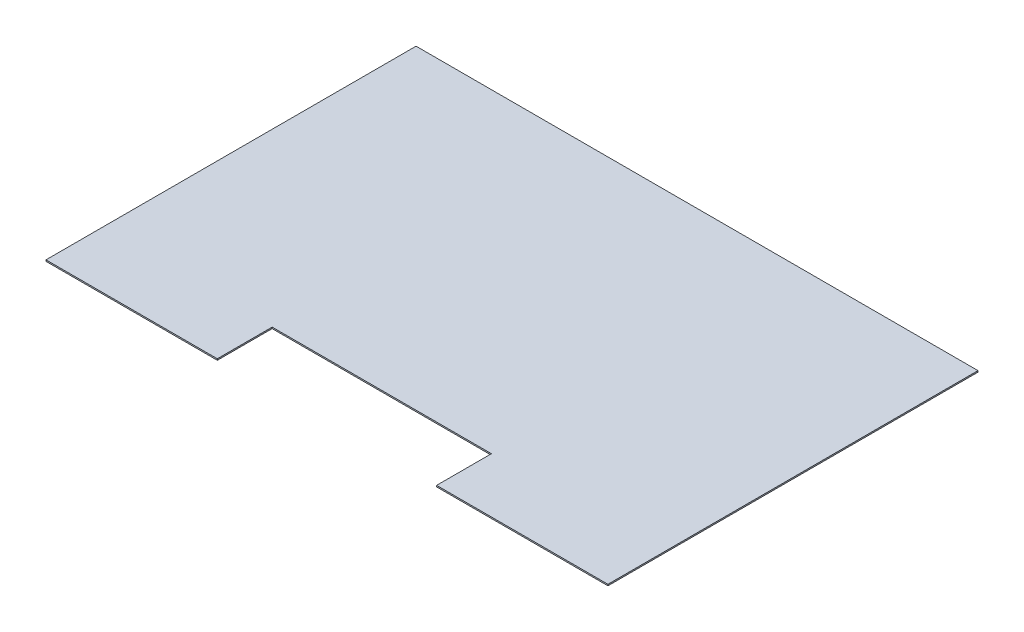
from build123d import *

# Parameters (mm, degrees)
DODANIE_WYCI_GNI_CIE1_DEPTH = 1


with BuildPart() as part:
    # Szkic1 → Dodanie-wyciągnięcie1 (new body)
    with BuildSketch(Plane(origin=(0, 0, 0), x_dir=(1, 0, 0), z_dir=(0, 1, 0))):
        Polygon((205, 135), (-205, 135), (-205, -135), (-80, -135), (-80, -95), (80, -95), (80, -135), (205, -135), align=None)
    extrude(amount=DODANIE_WYCI_GNI_CIE1_DEPTH)


solid = part.part
